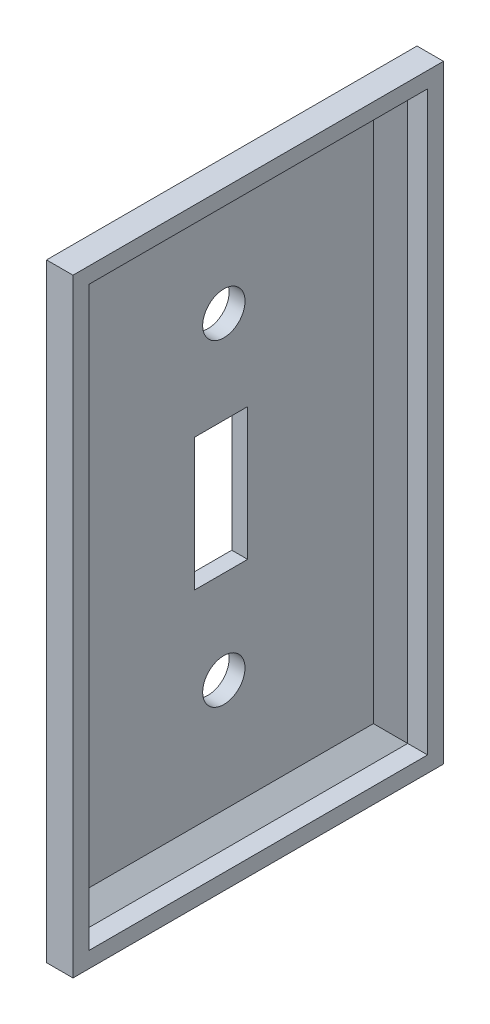
from build123d import *

# Parameters (mm, degrees)
CROQUIS1_W              = 70
CROQUIS1_H              = 115
SALIENTE_EXTRUIR1_DEPTH = 10
CHAFL_N2_SIZE           = 5
VACIADO1_T              = -3
CROQUIS5_R              = 4
CROQUIS5_W              = 10
CROQUIS5_H              = 25
CORTAR_EXTRUIR1_DEPTH   = 135.810978781


with BuildPart() as part:
    # Croquis1 → Saliente-Extruir1 (new body)
    with BuildSketch(Plane(origin=(0, 0, 0), x_dir=(0, 0, -1), z_dir=(1, 0, 0))):
        with Locations((35, 57.5)):
            Rectangle(CROQUIS1_W, CROQUIS1_H)
    extrude(amount=SALIENTE_EXTRUIR1_DEPTH)

    # Chaflán2
    chafl_n2_edges = [part.edges().sort_by_distance(p)[0] for p in [
        (0, 115, -35),
        (0, 57.5, -70),
        (0, 0, -35),
        (0, 57.5, 0),
    ]]
    chamfer(chafl_n2_edges, length=CHAFL_N2_SIZE)

    # Vaciado1
    vaciado1_openings = [part.faces().sort_by_distance(p)[0] for p in [
        (10, 57.5, -35),
    ]]
    offset(amount=VACIADO1_T, openings=vaciado1_openings, kind=Kind.INTERSECTION)

    # Croquis5 → Cortar-Extruir1 (cut, through all)
    with BuildSketch(Plane(origin=(3, 0, 0), x_dir=(0, 0, -1), z_dir=(1, 0, 0))):
        with Locations((35.5, 87.5)):
            Circle(CROQUIS5_R)
        with Locations((35.5, 27.5)):
            Circle(CROQUIS5_R)
        with Locations((35, 57.5)):
            Rectangle(CROQUIS5_W, CROQUIS5_H)
    extrude(amount=-CORTAR_EXTRUIR1_DEPTH, mode=Mode.SUBTRACT)


solid = part.part
